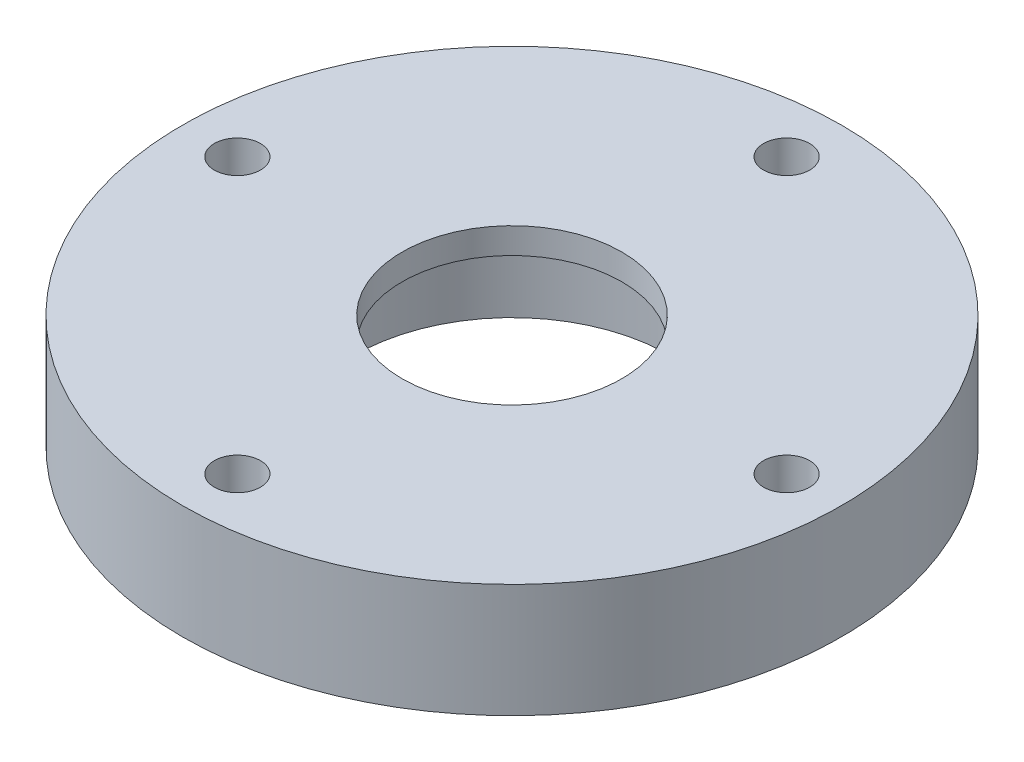
from build123d import *

# Parameters (mm, degrees)
SKETCH1_R           = 30
SKETCH1_R_2         = 10
SKETCH1_R_3         = 2.1
BOSS_EXTRUDE1_DEPTH = 10.35
SKETCH2_R           = 14.3875
CUT_EXTRUDE2_DEPTH  = 8


with BuildPart() as part:
    # Sketch1 → Boss-Extrude1 (new body)
    with BuildSketch(Plane(origin=(0, 0, 0), x_dir=(1, 0, 0), z_dir=(0, 1, 0))):
        with Locations(Location((0, 0, 0), (0, 0, 270))):
            Circle(SKETCH1_R)
        with Locations(Location((0, 0, 0), (0, 0, 270))):
            Circle(SKETCH1_R_2, mode=Mode.SUBTRACT)
        with Locations(Location((0, 25, 0), (0, 0, 270))):
            Circle(SKETCH1_R_3, mode=Mode.SUBTRACT)
        with Locations(Location((25, 0, 0), (0, 0, 270))):
            Circle(SKETCH1_R_3, mode=Mode.SUBTRACT)
        with Locations(Location((0, -25, 0), (0, 0, 270))):
            Circle(SKETCH1_R_3, mode=Mode.SUBTRACT)
        with Locations(Location((-25, 0, 0), (0, 0, 270))):
            Circle(SKETCH1_R_3, mode=Mode.SUBTRACT)
    extrude(amount=BOSS_EXTRUDE1_DEPTH)

    # Sketch2 → Cut-Extrude2 (cut)
    with BuildSketch(Plane(origin=(0, 0, 0), x_dir=(1, 0, 0), z_dir=(0, 1, 0))):
        with Locations(Location((0, 0, 0), (0, 0, 270))):
            Circle(SKETCH2_R)
    extrude(amount=CUT_EXTRUDE2_DEPTH, mode=Mode.SUBTRACT)


solid = part.part
